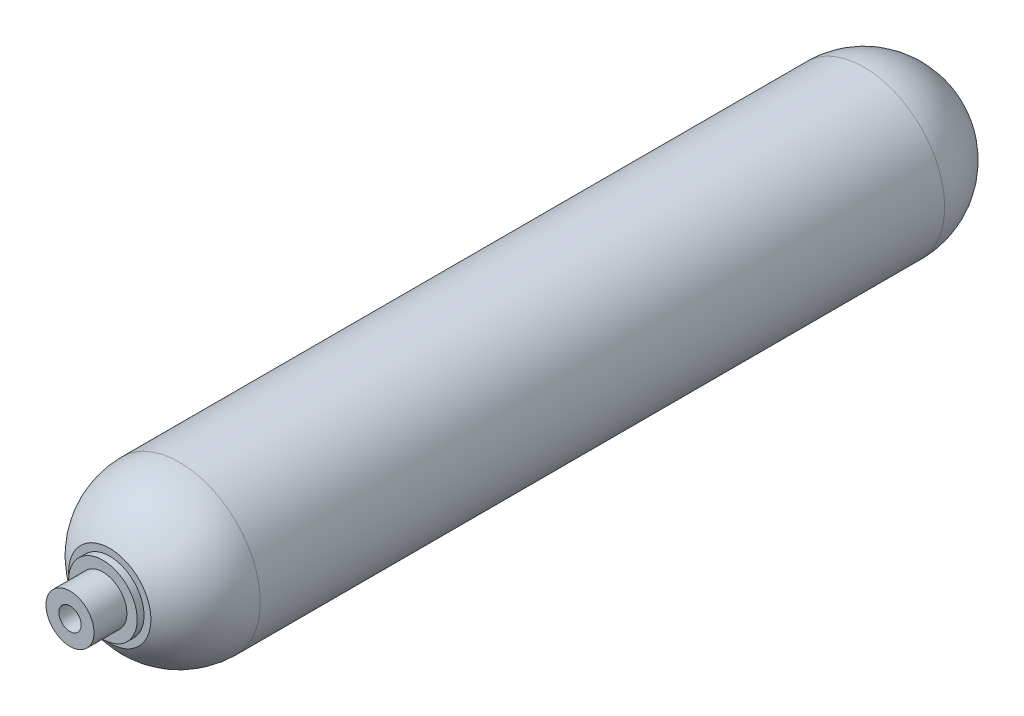
from build123d import *

# Parameters (mm, degrees)
SKETCH4_R                  = 22.225
BOSS_EXTRUDE1_DEPTH        = 30.48
F_7_8_14_UNF_FITTING_D     = 20.6375
F_7_8_14_UNF_FITTING_DEPTH = 49.784
F_7_8_14_UNF_FITTING_TIP   = 6.200130513


with BuildPart() as part:
    # Sketch1 → Revolve1 (revolve)
    with BuildSketch(Plane(origin=(0, 0, 0), x_dir=(1, 0, 0), z_dir=(0, 1, 0)), mode=Mode.PRIVATE) as revolve1_sk:
        with BuildLine():
            Line((0, 0), (31.75, 0))
            Line((31.75, 0), (31.75, 6.35))
            Line((31.75, 6.35), (38.1, 6.35))
            ThreePointArc((38.1, 6.35), (65.074334034, 33.724356705), (74.93, 70.870499843))
            Line((74.93, 70.870499843), (74.93, 704.85))
            ThreePointArc((74.93, 704.85), (52.983511114, 757.833511114), (0, 779.78))
            Line((0, 779.78), (0, 776.605))
            ThreePointArc((0, 776.605), (50.738447084, 755.588447084), (71.755, 704.85))
            Line((71.755, 704.85), (71.755, 70.870499843))
            ThreePointArc((71.755, 70.870499843), (63.375644219, 37.220719089), (40.194614109, 11.43))
            Line((40.194614109, 11.43), (26.67, 11.43))
            Line((26.67, 11.43), (26.67, 5.08))
            Line((26.67, 5.08), (0, 5.08))
            Line((0, 5.08), (0, 0))
        make_face()
    revolve(revolve1_sk.sketch.rotate(Axis((0, 0, -704.85), (0, 0, 1)), 180), axis=Axis((0, 0, -704.85), (0, 0, 1)))

    # Sketch4 → Boss-Extrude1 (add)
    with BuildSketch(Plane.XY):
        with Locations(Location((0, 0, 0), (0, 0, 180))):
            Circle(SKETCH4_R)
    extrude(amount=BOSS_EXTRUDE1_DEPTH)

    # 7/8-14 UNF Fitting
    with Locations(Plane(origin=(-8.590582688, 4.968077157, 30.48), x_dir=(1, 0, 0), z_dir=(0, 0, 1))):
        with Locations((8.590582688, -4.968077157)):
            Hole(F_7_8_14_UNF_FITTING_D / 2, depth=F_7_8_14_UNF_FITTING_DEPTH)
            with Locations((0, 0, -(F_7_8_14_UNF_FITTING_DEPTH + F_7_8_14_UNF_FITTING_TIP / 2))):  # 118° drill point
                Cone(0, F_7_8_14_UNF_FITTING_D / 2, F_7_8_14_UNF_FITTING_TIP, mode=Mode.SUBTRACT)


solid = part.part
